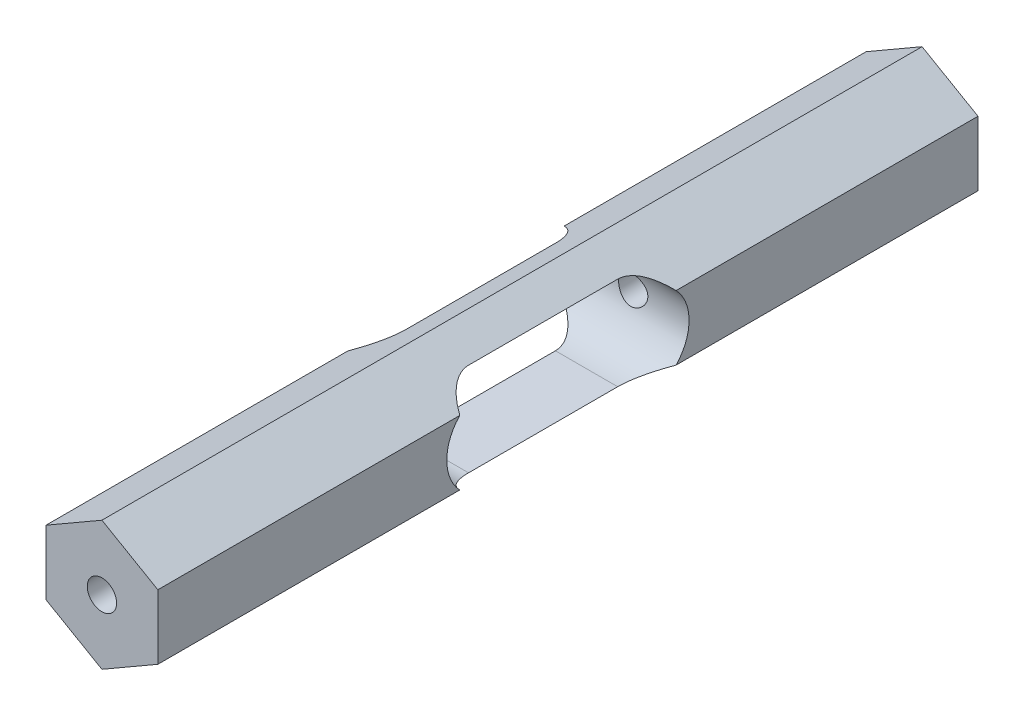
from build123d import *

# Parameters (mm, degrees)
BOSS_EXTRUDE1_DEPTH     = 34.925
CUT_EXTRUDE4_DEPTH      = 36.674625524
CUT_EXTRUDE4_DEPTH_BACK = 36.674625524
CUT_EXTRUDE5_DEPTH      = 36.674625524
CUT_EXTRUDE5_DEPTH_BACK = 36.674625524
SKETCH6_R               = 1.25


with BuildPart() as part:
    # Sketch1 → Boss-Extrude1 (new, symmetric)
    with BuildSketch(Plane.XY):
        Polygon((0, 5.499261314), (-4.7625, 2.749630657), (-4.7625, -2.749630657), (0, -5.499261314), (4.7625, -2.749630657), (4.7625, 2.749630657), align=None)
    extrude(amount=BOSS_EXTRUDE1_DEPTH, both=True)

    # Sketch5 → Cut-Extrude4 (cut, two sides: drawn at the far end of the back side and taken through both)
    with BuildSketch(Plane(origin=(0, 0, 0), x_dir=(0, 0, -1), z_dir=(1, 0, 0)).offset(-CUT_EXTRUDE4_DEPTH_BACK)):
        with BuildLine():
            Line((-6.35, 3.96875), (6.35, 3.96875))
            ThreePointArc((6.35, 3.96875), (10.31875, 0), (6.35, -3.96875))
            Line((6.35, -3.96875), (-6.35, -3.96875))
            ThreePointArc((-6.35, -3.96875), (-10.31875, 0), (-6.35, 3.96875))
        make_face()
    extrude(amount=CUT_EXTRUDE4_DEPTH + CUT_EXTRUDE4_DEPTH_BACK, mode=Mode.SUBTRACT)

    # Sketch6 → Cut-Extrude5 (cut, two sides: drawn at the far end of the back side and taken through both)
    with BuildSketch(Plane.XY.offset(-CUT_EXTRUDE5_DEPTH_BACK)):
        Circle(SKETCH6_R)
    extrude(amount=CUT_EXTRUDE5_DEPTH + CUT_EXTRUDE5_DEPTH_BACK, mode=Mode.SUBTRACT)


solid = part.part
